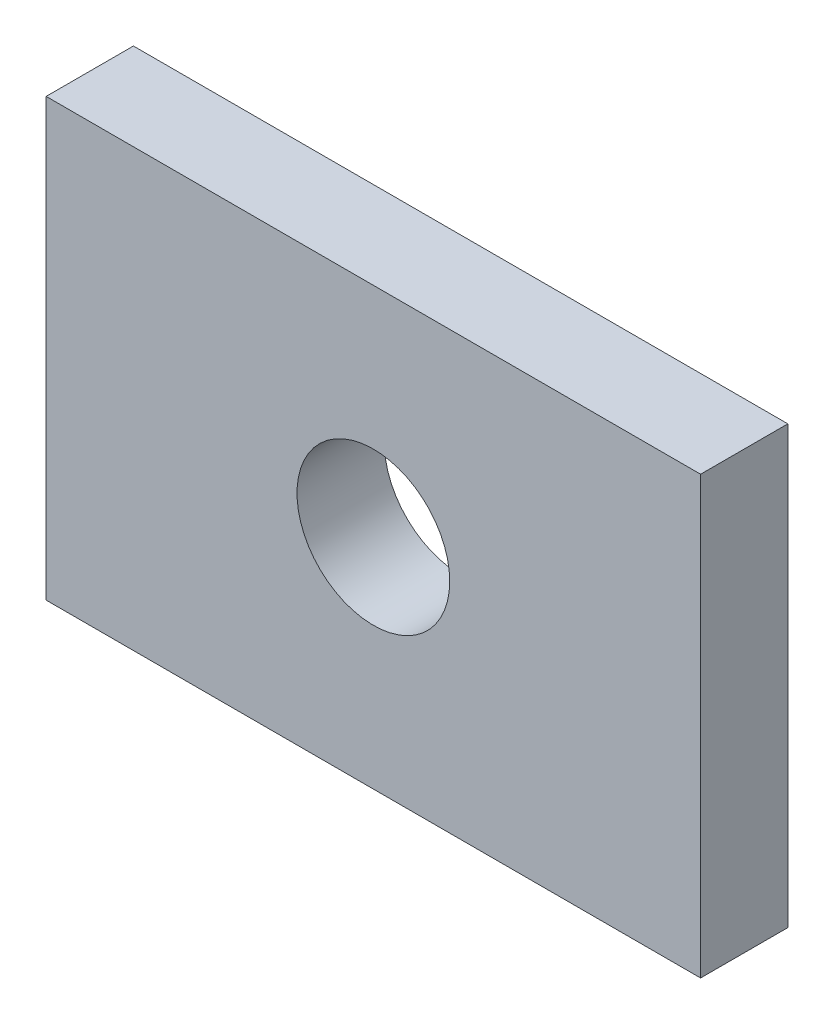
from build123d import *

# Parameters (mm, degrees)
ESQUISSE2_W        = 15
ESQUISSE2_H        = 10
ESQUISSE2_R        = 1.75
BOSS_EXTRU_1_DEPTH = 2


with BuildPart() as part:
    # Esquisse2 → Boss.-Extru.1 (new body)
    with BuildSketch(Plane.XY):
        Rectangle(ESQUISSE2_W, ESQUISSE2_H)
        Circle(ESQUISSE2_R, mode=Mode.SUBTRACT)
    extrude(amount=BOSS_EXTRU_1_DEPTH)


solid = part.part
